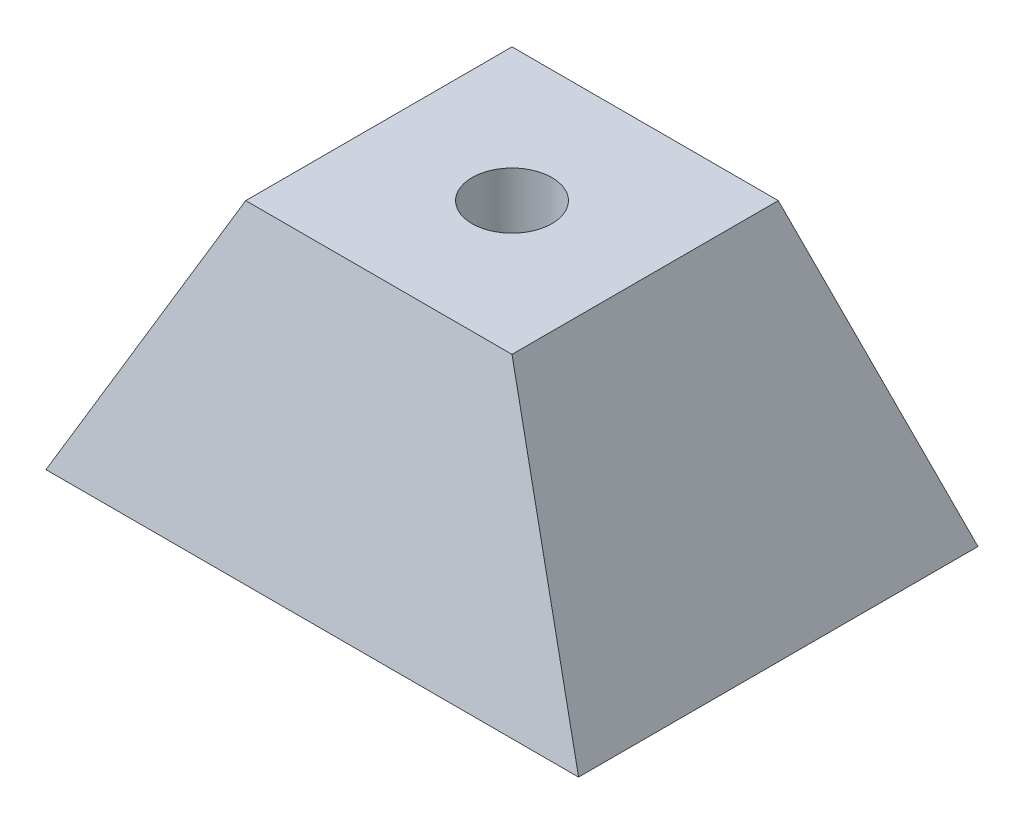
from build123d import *

# Parameters (mm, degrees)
SKETCH3_R          = 1.905
CUT_EXTRUDE1_DEPTH = 21.329919626


with BuildPart() as part:
    # Sketch2 → Loft1 section 0
    with BuildSketch(Plane(origin=(0, 12.7, 0), x_dir=(1, 0, 0), z_dir=(0, 1, 0))):
        with BuildLine():
            Line((-6.35, -6.35), (6.35, -6.35))
            Line((6.35, -6.35), (6.35, 6.35))
            Line((6.35, 6.35), (-6.35, 6.35))
            Line((-6.35, 6.35), (-6.35, -6.35))
        make_face()
    # Sketch1 → Loft1 section 1
    with BuildSketch(Plane(origin=(0, 0, 0), x_dir=(1, 0, 0), z_dir=(0, 1, 0))):
        with BuildLine():
            Line((-12.7, -9.525), (12.7, -9.525))
            Line((12.7, -9.525), (12.7, 9.525))
            Line((12.7, 9.525), (-12.7, 9.525))
            Line((-12.7, 9.525), (-12.7, -9.525))
        make_face()
    loft()

    # Sketch3 → Cut-Extrude1 (cut, through all)
    with BuildSketch(Plane(origin=(0, 12.7, 0), x_dir=(1, 0, 0), z_dir=(0, 1, 0))):
        with Locations(Location((0, 0, 0), (0, 0, 270))):
            Circle(SKETCH3_R)
    extrude(amount=-CUT_EXTRUDE1_DEPTH, mode=Mode.SUBTRACT)


solid = part.part
